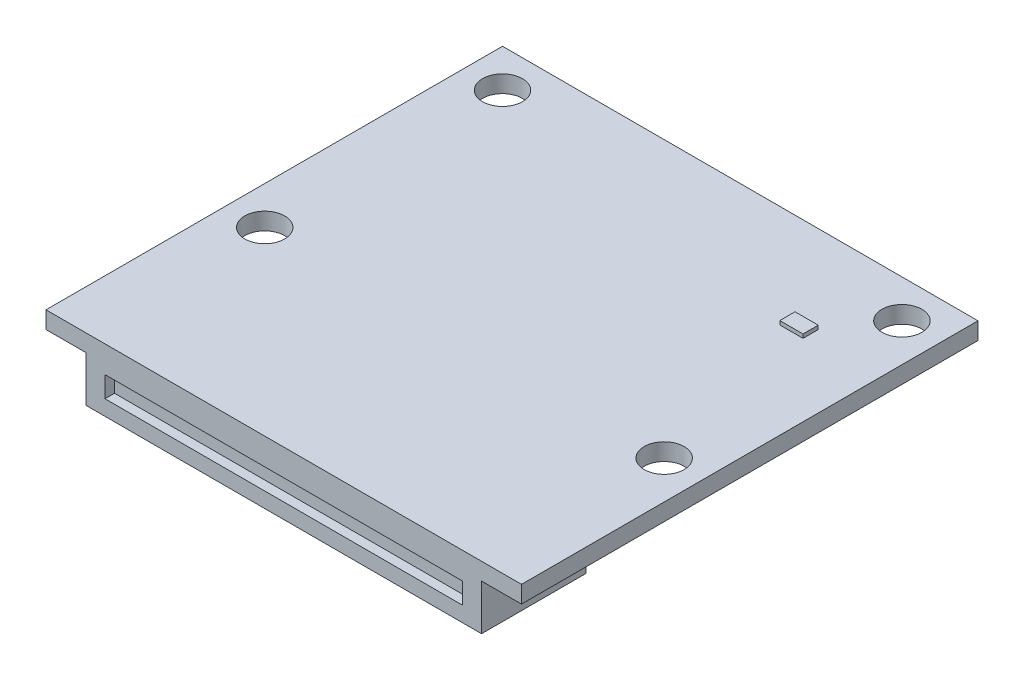
from build123d import *

# Parameters (mm, degrees)
SKIZZE1_W               = 25
SKIZZE1_H               = 24
PCB_DEPTH               = 0.9
SKIZZE2_R               = 1.05
MOUNTING_HOLES_DEPTH    = 20.165333287
SKIZZE3_W               = 20.8
SKIZZE3_H               = 5.5
CONNECTOR_CLOSED_DEPTH  = 2.4
ESQUISSE1_W             = 1.22
ESQUISSE1_H             = 0.8
STATUS_LED_DEPTH        = 0.2
ESQUISSE3_W             = 18.8
ESQUISSE3_H             = 1.1
ENL_V_MAT_EXTRU_1_DEPTH = 0.5


with BuildPart() as part:
    # Skizze1 → PCB (new body)
    with BuildSketch(Plane(origin=(0, 0, 0), x_dir=(1, 0, 0), z_dir=(0, 1, 0))):
        with Locations((0, 2.5)):
            Rectangle(SKIZZE1_W, SKIZZE1_H)
    extrude(amount=-PCB_DEPTH)

    # Skizze2 → Mounting_Holes (cut, through all)
    with BuildSketch(Plane(origin=(0, 0, 0), x_dir=(1, 0, 0), z_dir=(0, 1, 0))):
        with Locations(Location((10.5, 12.5, 0), (0, 0, 270))):
            Circle(SKIZZE2_R)
        with Locations(Location((10.5, 0, 0), (0, 0, 270))):
            Circle(SKIZZE2_R)
        with Locations(Location((-10.5, 0, 0), (0, 0, 90))):
            Circle(SKIZZE2_R)
        with Locations(Location((-10.5, 12.5, 0), (0, 0, 90))):
            Circle(SKIZZE2_R)
    extrude(amount=-MOUNTING_HOLES_DEPTH, mode=Mode.SUBTRACT)

    # Skizze3 → Connector_closed (add)
    with BuildSketch(Plane.XZ.offset(0.9)):
        with Locations((0, 6.75)):
            Rectangle(SKIZZE3_W, SKIZZE3_H)
    extrude(amount=CONNECTOR_CLOSED_DEPTH)

    # Esquisse1 → Status LED (add)
    with BuildSketch(Plane(origin=(0, 0, 0), x_dir=(1, 0, 0), z_dir=(0, 1, 0))):
        with Locations((8.09, 9.5)):
            Rectangle(ESQUISSE1_W, ESQUISSE1_H)
    extrude(amount=STATUS_LED_DEPTH)

    # Esquisse3 → Enlèv. mat.-Extru.1 (cut)
    with BuildSketch(Plane.XY.offset(9.5)):
        with Locations((0, -1.95)):
            Rectangle(ESQUISSE3_W, ESQUISSE3_H)
    extrude(amount=-ENL_V_MAT_EXTRU_1_DEPTH, mode=Mode.SUBTRACT)


solid = part.part
